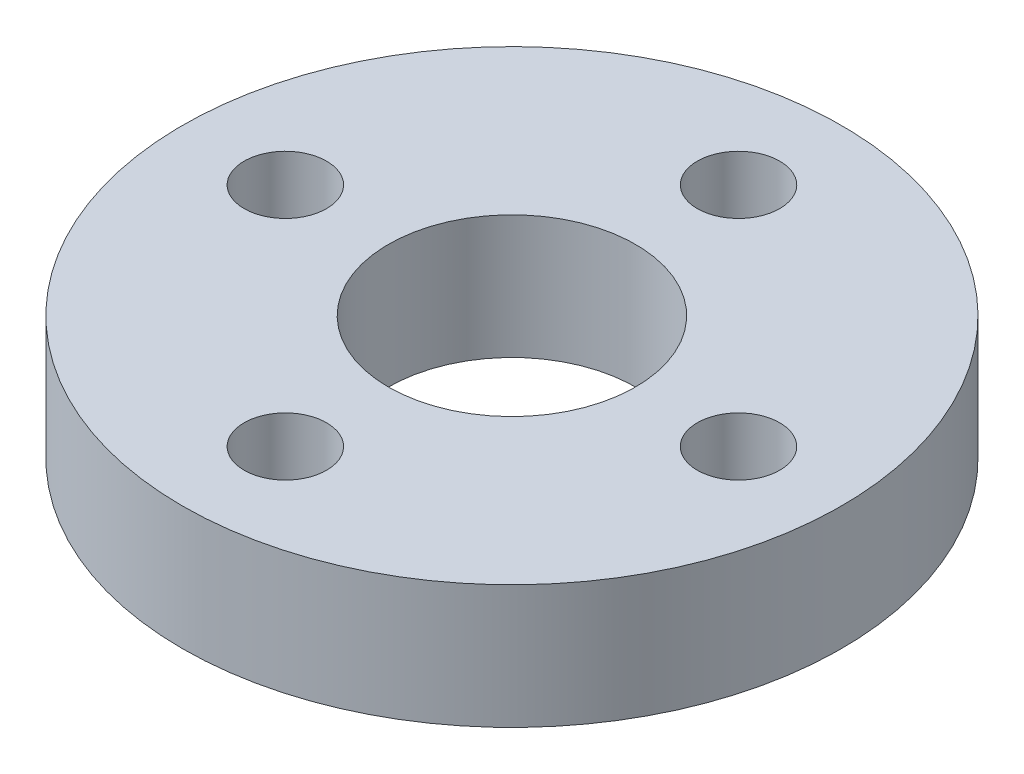
from build123d import *

# Parameters (mm, degrees)
SKETCH1_R           = 8
SKETCH1_R_2         = 3
SKETCH1_R_3         = 1
BOSS_EXTRUDE1_DEPTH = 3


with BuildPart() as part:
    # Sketch1 → Boss-Extrude1 (new body)
    with BuildSketch(Plane(origin=(0, 0, 0), x_dir=(1, 0, 0), z_dir=(0, 1, 0))):
        with Locations(Location((0, 0, 0), (0, 0, 270))):
            Circle(SKETCH1_R)
        with Locations(Location((0, 0, 0), (0, 0, 270))):
            Circle(SKETCH1_R_2, mode=Mode.SUBTRACT)
        with Locations(Location((0, 5.5, 0), (0, 0, 270))):
            Circle(SKETCH1_R_3, mode=Mode.SUBTRACT)
        with Locations(Location((5.5, 0, 0), (0, 0, 270))):
            Circle(SKETCH1_R_3, mode=Mode.SUBTRACT)
        with Locations(Location((0, -5.5, 0), (0, 0, 270))):
            Circle(SKETCH1_R_3, mode=Mode.SUBTRACT)
        with Locations(Location((-5.5, 0, 0), (0, 0, 270))):
            Circle(SKETCH1_R_3, mode=Mode.SUBTRACT)
    extrude(amount=BOSS_EXTRUDE1_DEPTH)


solid = part.part
